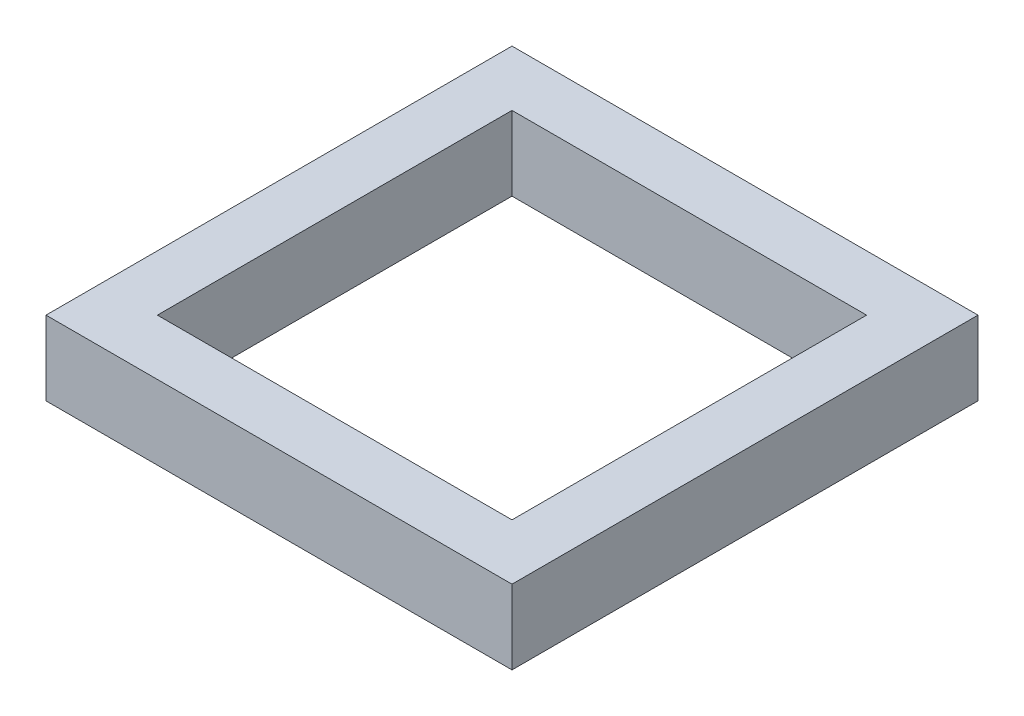
from build123d import *

# Parameters (mm, degrees)
SKETCH1_W           = 25.1
SKETCH1_H           = 25.1
SKETCH1_W_2         = 19.1
SKETCH1_H_2         = 19.1
BOSS_EXTRUDE1_DEPTH = 4


with BuildPart() as part:
    # Sketch1 → Boss-Extrude1 (new body)
    with BuildSketch(Plane(origin=(0, 0, 0), x_dir=(1, 0, 0), z_dir=(0, 1, 0))):
        Rectangle(SKETCH1_W, SKETCH1_H)
        Rectangle(SKETCH1_W_2, SKETCH1_H_2, mode=Mode.SUBTRACT)
    extrude(amount=BOSS_EXTRUDE1_DEPTH)


solid = part.part
